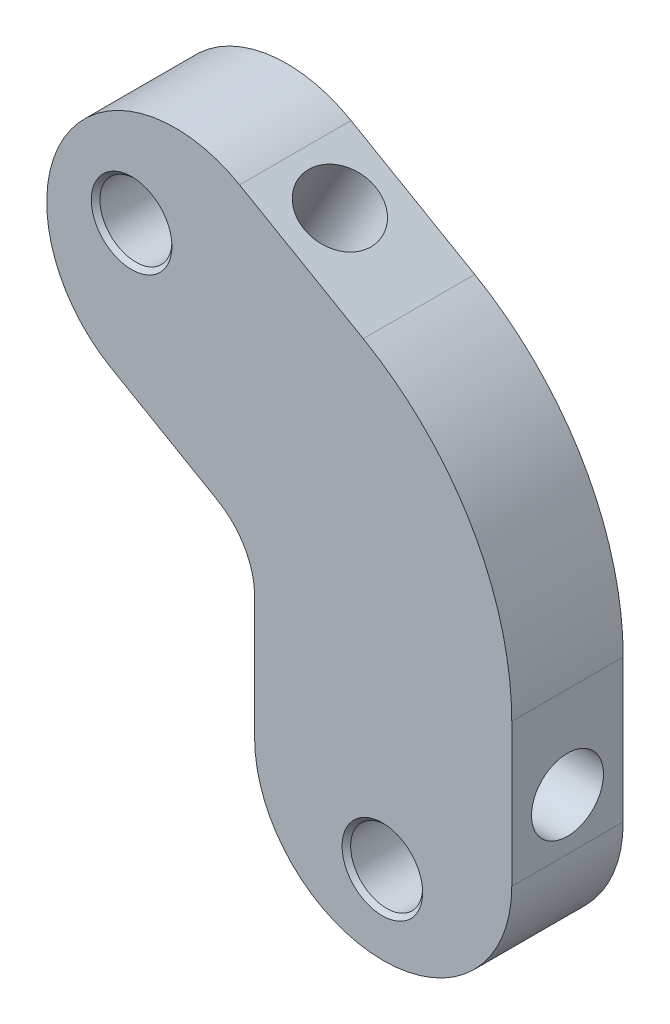
from build123d import *

# Parameters (mm, degrees)
BOSS_EXTRUDE1_DEPTH        = 13
CUT_EXTRUDE1_DEPTH         = 55.223360011
CUT_EXTRUDE2_DEPTH         = 55.01851513
F_8_4_8_4_DIAMETER_HOLE1_D = 8.4
CHAMFER2_SIZE              = 0.5


with BuildPart() as part:
    # Sketch1 → Boss-Extrude1 (new body)
    with BuildSketch(Plane(origin=(0, 0, 0), x_dir=(-1, 0, 0), z_dir=(0, 0, -1))):
        with BuildLine():
            Line((-14.999999535, -11.339745693), (-14.999999535, -27.999999731))
            ThreePointArc((-14.999999535, -27.999999731), (4.65e-07, -42.999999731), (15.000000465, -27.999999731))
            Line((15.000000465, -27.999999731), (15.000000465, -13.660253769))
            ThreePointArc((15.000000465, -13.660253769), (16.160254503, -9.33012675), (19.330127484, -6.160253769))
            Line((19.330127484, -6.160253769), (31.748711306, 1.009618943))
            ThreePointArc((31.748711306, 1.009618943), (37.239092363, 6.5), (39.248711306, 14))
            ThreePointArc((39.248711306, 14), (37.239092363, 21.5), (31.748711306, 26.990381057))
            ThreePointArc((31.748711306, 26.990381057), (24.248711306, 29), (16.748711306, 26.990381057))
            Line((16.748711306, 26.990381057), (2.320508541, 18.660254307))
            ThreePointArc((2.320508541, 18.660254307), (-10.358983383, 5.980762382), (-14.999999535, -11.339745693))
        make_face()
    extrude(amount=-BOSS_EXTRUDE1_DEPTH)

    # Sketch2 → Cut-Extrude1 (cut, through all)
    with BuildSketch(Plane(origin=(-7.5, -12.990381057, 0), x_dir=(0.8660254037844388, -0.4999999999999997, 0), z_dir=(-0.4999999999999997, -0.8660254037844388, 0))):
        with BuildLine():
            ThreePointArc((-25.021227161, 9.417565156), (-22, 2.3), (-18.978772839, 9.417565156))
            ThreePointArc((-18.978772839, 9.417565156), (-22, 10.7), (-25.021227161, 9.417565156))
        make_face()
    extrude(amount=-CUT_EXTRUDE1_DEPTH, mode=Mode.SUBTRACT)

    # Sketch3 → Cut-Extrude2 (cut, through all)
    with BuildSketch(Plane.ZY.offset(15.000000465)):
        with BuildLine():
            ThreePointArc((9.417565156, -18.978772839), (2.3, -22), (9.417565156, -25.021227161))
            ThreePointArc((9.417565156, -25.021227161), (10.7, -22), (9.417565156, -18.978772839))
        make_face()
    extrude(amount=-CUT_EXTRUDE2_DEPTH, mode=Mode.SUBTRACT)

    # Ø8.4 (8.4) Diameter Hole1 (through all)
    with Locations(Plane(origin=(0, 0, 0), x_dir=(-1, 0, 0), z_dir=(0, 0, -1))):
        with Locations((29.347432097, 16.831243464), (0.097432097, -33.831242658)):
            Hole(F_8_4_8_4_DIAMETER_HOLE1_D / 2)

    # Chamfer2
    chamfer2_edges = [part.edges().sort_by_distance(p)[0] for p in [
        (-4.297432097, -33.831242658, 0),
        (-4.297432097, -33.831242658, 13),
        (-33.547432097, 16.831243464, 0),
        (-33.547432097, 16.831243464, 13),
    ]]
    chamfer(chamfer2_edges, length=CHAMFER2_SIZE)


solid = part.part
